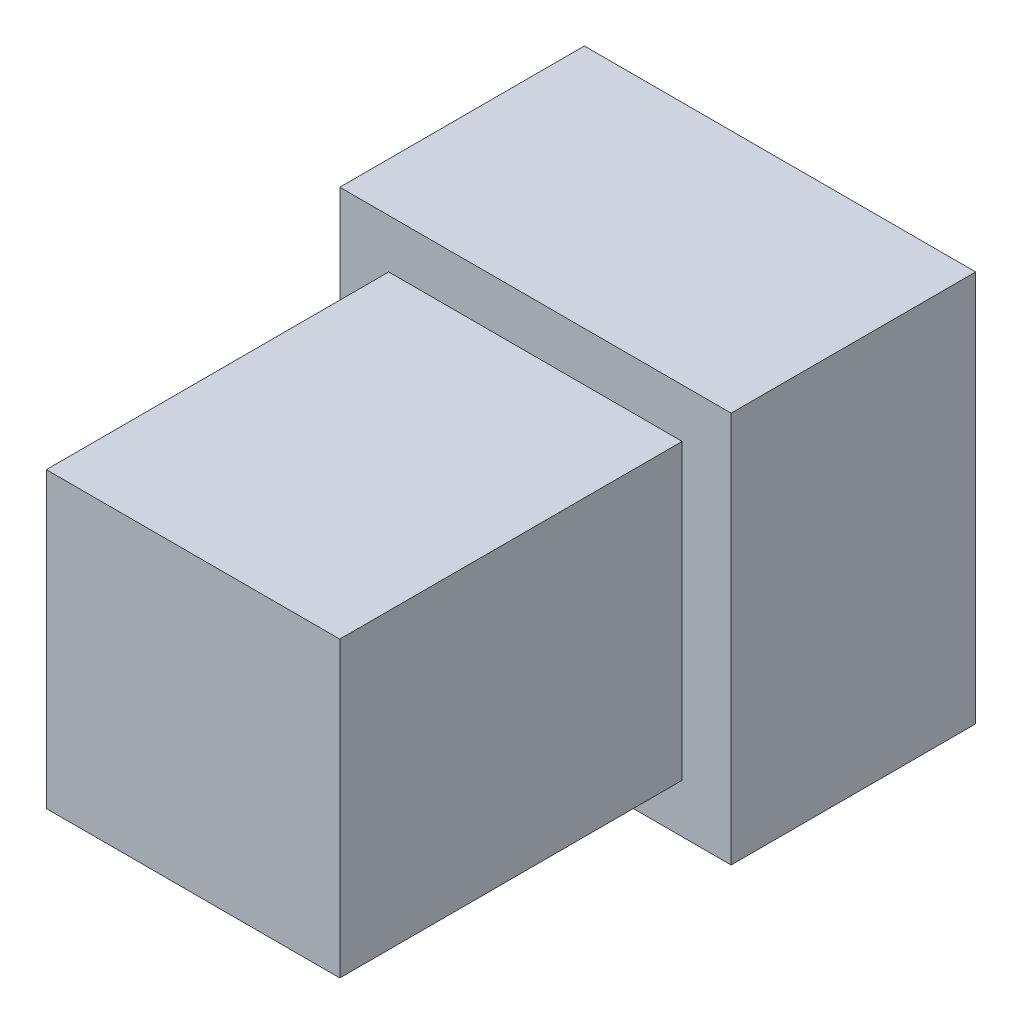
from build123d import *

# Parameters (mm, degrees)
SKETCH1_W           = 8
SKETCH1_H           = 8
BOSS_EXTRUDE1_DEPTH = 5
SKETCH3_W           = 6
SKETCH3_H           = 6
BOSS_EXTRUDE2_DEPTH = 7


with BuildPart() as part:
    # Sketch1 → Boss-Extrude1 (new body)
    with BuildSketch(Plane.XY):
        Rectangle(SKETCH1_W, SKETCH1_H)
    extrude(amount=BOSS_EXTRUDE1_DEPTH)

    # Sketch3 → Boss-Extrude2 (add)
    with BuildSketch(Plane.XY.offset(5)):
        Rectangle(SKETCH3_W, SKETCH3_H)
    extrude(amount=BOSS_EXTRUDE2_DEPTH)


solid = part.part
